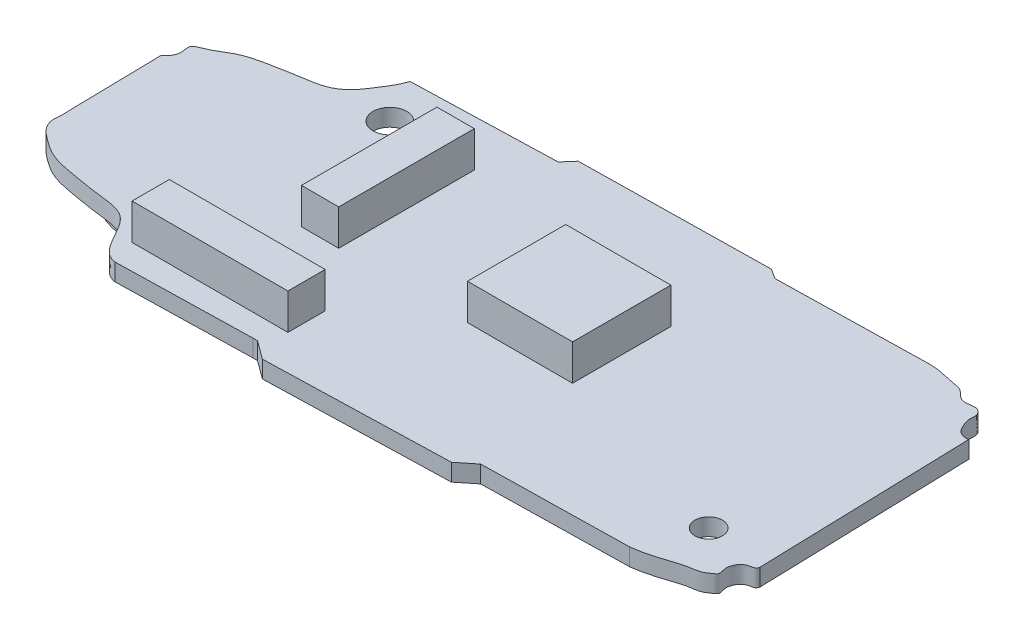
from build123d import *

# Parameters (mm, degrees)
SKETCH_1_R      = 1.177850969
SKETCH_1_R_2    = 0.956106654
EXTRUDE_1_DEPTH = 1.2
SKETCH_2_W      = 2.599009716
SKETCH_2_H      = 9.450944424
SKETCH_2_W_2    = 10.868586088
SKETCH_2_H_2    = 2.599009716
SKETCH_2_W_3    = 7.324481929
SKETCH_2_H_3    = 6.851934707
EXTRUDE_2_DEPTH = 2.5
SKETCH_3_R      = 5.169319594
SKETCH_3_W      = 5.663714124
SKETCH_3_H      = 8.228414859
SKETCH_3_W_2    = 2.778425797
SKETCH_3_H_2    = 3.41960098
SKETCH_3_W_3    = 2.778425796
EXTRUDE_3_DEPTH = 2.5


with BuildPart() as part:
    # 草图1 → 凸台-拉伸1 (new body)
    with BuildSketch(Plane(origin=(0, 0, 0), x_dir=(1, 0, 0), z_dir=(0, 1, 0))):
        with BuildLine():
            Line((105.893591271, 53.275125851), (106.545491392, 54.017421076))
            Line((106.545491392, 54.017421076), (119.800793841, 54.234721116))
            Line((119.800793841, 54.234721116), (120.490485419, 53.791652828))
            Line((120.490485419, 53.791652828), (131.147108858, 54.017421076))
            add(Edge.make_bspline(
                [(131.147108858, 54.017421076), (131.789812794, 53.996837003), (132.271032583, 53.806185271), (133.59141416, 53.64309442), (133.864212106, 53.332445087), (134.378478508, 52.88451723), (134.906596474, 52.964229893), (135.436516912, 53.046704607), (135.857819818, 52.60303085), (135.699488705, 52.022001546), (135.915728679, 51.540366189), (136.18029414, 50.941982759), (136.67307375, 50.758709494), (136.967497013, 50.83035382)],
                knots=[0, 0, 0, 0, 0.188730146, 0.316316472, 0.403184148, 0.474447883, 0.548055379, 0.606941376, 0.67849208, 0.743591437, 0.828920553, 0.87978435, 1, 1, 1, 1], degree=3))
            Line((136.967497013, 50.83035382), (137.402097093, 35.83665105))
            add(Edge.make_bspline(
                [(131.638888225, 32.519167476), (132.289752245, 32.591172314), (133.399864021, 32.891144985), (134.719329611, 33.372405259), (135.679325757, 33.455694566), (136.069567013, 33.777495704), (136.465876162, 34.019032832), (136.210256018, 34.494885125), (136.309070885, 34.9305834), (136.493026809, 35.307181869), (136.911878339, 35.60133562), (137.35507181, 35.550553674), (137.402097093, 35.83665105)],
                knots=[0, 0, 0, 0, 0.265050769, 0.461165322, 0.575032701, 0.635406808, 0.669813837, 0.743469123, 0.801324936, 0.85139451, 0.909102062, 1, 1, 1, 1], degree=3))
            Line((131.638888225, 32.519167476), (121.435281065, 32.328801671))
            Line((121.435281065, 32.328801671), (120.307827268, 31.4182169))
            Line((120.307827268, 31.4182169), (107.487124899, 31.056050167))
            Line((107.487124899, 31.056050167), (106.206955659, 31.997683674))
            Line((106.206955659, 31.997683674), (105.893591271, 31.997683674))
            Line((105.893591271, 31.997683674), (96.477256198, 31.780383634))
            add(Edge.make_bspline(
                [(96.477256198, 31.780383634), (95.119394991, 31.979098062), (94.768281493, 35.025160472), (91.7555269, 35.258354273), (89.816296815, 35.594946638), (87.972336143, 35.939221074), (86.505310233, 36.951790617), (85.565925603, 37.723763036), (85.757120884, 38.661551572)],
                knots=[0, 0, 0, 0, 0.292440776, 0.436631494, 0.610009415, 0.740354216, 0.839144899, 1, 1, 1, 1], degree=3))
            Line((85.757120884, 38.661551572), (85.61225419, 45.832452897))
            add(Edge.make_bspline(
                [(95.865148312, 52.970520199), (95.699375208, 52.414012473), (95.170628458, 51.625033595), (94.478178944, 50.509216035), (93.429531129, 49.673120616), (91.694996172, 49.414444997), (89.907832195, 49.103478144), (88.214733513, 48.696875462), (87.251206893, 47.989012234), (86.546009542, 47.716130479), (85.959637368, 47.453239242), (86.287299163, 46.596327956), (85.902100101, 46.067142496), (85.61225419, 45.832452897)],
                knots=[0, 0, 0, 0, 0.125583195, 0.209641712, 0.288634899, 0.412114343, 0.586659681, 0.693684, 0.791997458, 0.841790879, 0.868337506, 0.916807277, 1, 1, 1, 1], degree=3))
            Line((95.865148312, 52.970520199), (105.893591271, 53.275125851))
        make_face()
        with Locations(Location((97.560690211, 49.871714609, 0), (0, 0, 270))):
            Circle(SKETCH_1_R, mode=Mode.SUBTRACT)
        with Locations(Location((133.245133696, 36.418008614, 0), (0, 0, 270))):
            Circle(SKETCH_1_R_2, mode=Mode.SUBTRACT)
    extrude(amount=EXTRUDE_1_DEPTH)

    # 草图2 → 凸台-拉伸2 (add)
    with BuildSketch(Plane(origin=(0, 1.2, 0), x_dir=(1, 0, 0), z_dir=(0, 1, 0))):
        with Locations((102.156162403, 45.136585694)):
            Rectangle(SKETCH_2_W, SKETCH_2_H)
        with Locations((101.329204766, 34.858683633)):
            Rectangle(SKETCH_2_W_2, SKETCH_2_H_2)
        with Locations((116.096305429, 43.837080836)):
            Rectangle(SKETCH_2_W_3, SKETCH_2_H_3)
    extrude(amount=EXTRUDE_2_DEPTH)

    # 草图3 → 凸台-拉伸3 (add)
    with BuildSketch(Plane(origin=(0, 0, 0), x_dir=(-1, 0, 0), z_dir=(0, -1, 0))):
        with Locations(Location((-91.879503332, 42.457445362, 0), (0, 0, 270))):
            Circle(SKETCH_3_R)
        with Locations((-116.618179174, 42.404014097)):
            Rectangle(SKETCH_3_W, SKETCH_3_H)
        with Locations((-122.549049625, 42.778032954)):
            Rectangle(SKETCH_3_W_2, SKETCH_3_H_2)
        with Locations((-110.473583663, 42.778032954)):
            Rectangle(SKETCH_3_W_3, SKETCH_3_H_2)
    extrude(amount=EXTRUDE_3_DEPTH)


solid = part.part
